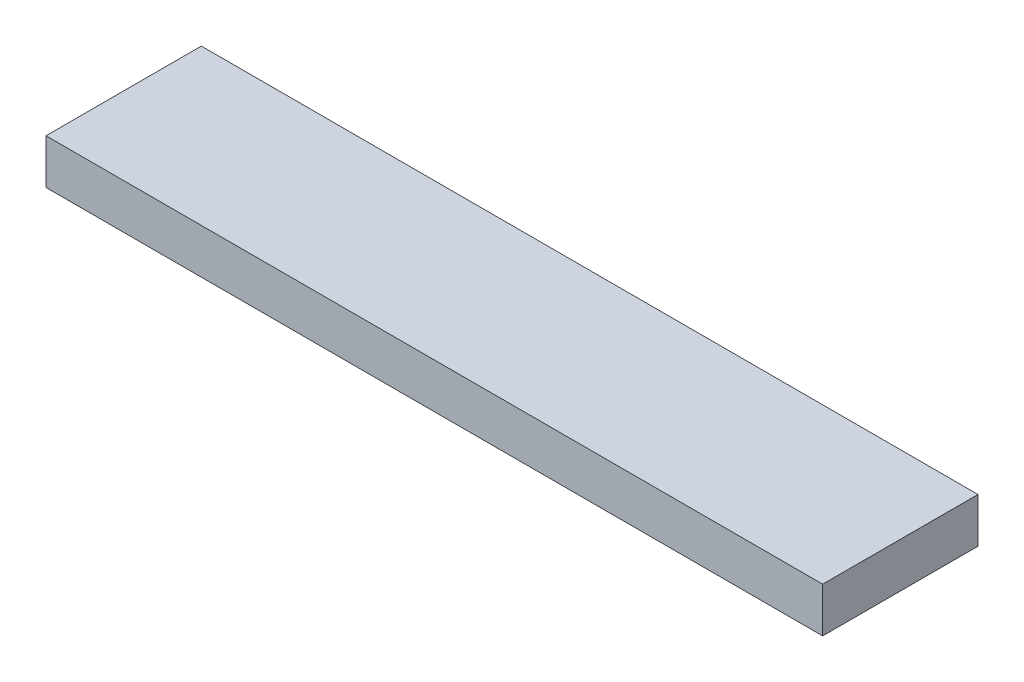
from build123d import *

# Parameters (mm, degrees)
SKETCH1_W           = 55
SKETCH1_H           = 11
BOSS_EXTRUDE1_DEPTH = 3.175


with BuildPart() as part:
    # Sketch1 → Boss-Extrude1 (new body)
    with BuildSketch(Plane(origin=(0, 0, 0), x_dir=(1, 0, 0), z_dir=(0, 1, 0))):
        Rectangle(SKETCH1_W, SKETCH1_H)
    extrude(amount=BOSS_EXTRUDE1_DEPTH)


solid = part.part
